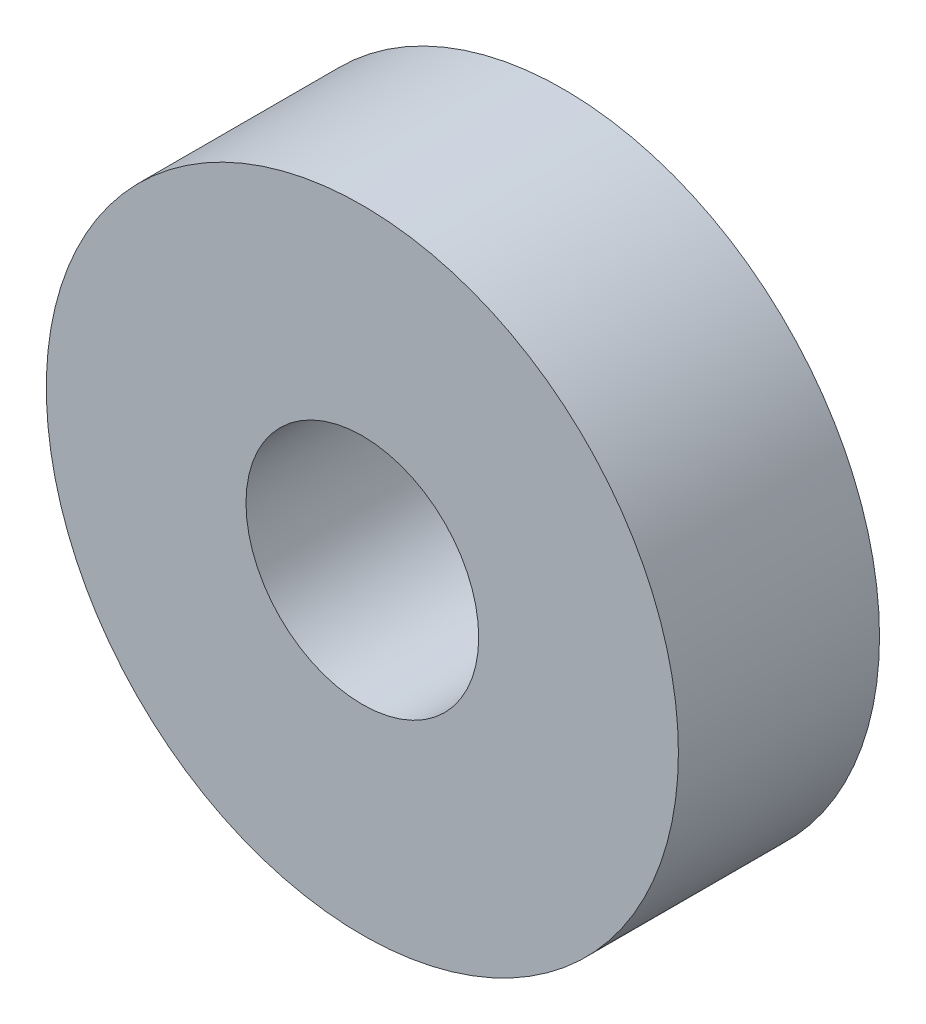
from build123d import *

# Parameters (mm, degrees)
SKETCH1_R           = 11
SKETCH1_R_2         = 4.05
BOSS_EXTRUDE1_DEPTH = 7


with BuildPart() as part:
    # Sketch1 → Boss-Extrude1 (new body)
    with BuildSketch(Plane.XY):
        Circle(SKETCH1_R)
        Circle(SKETCH1_R_2, mode=Mode.SUBTRACT)
    extrude(amount=BOSS_EXTRUDE1_DEPTH)


solid = part.part
